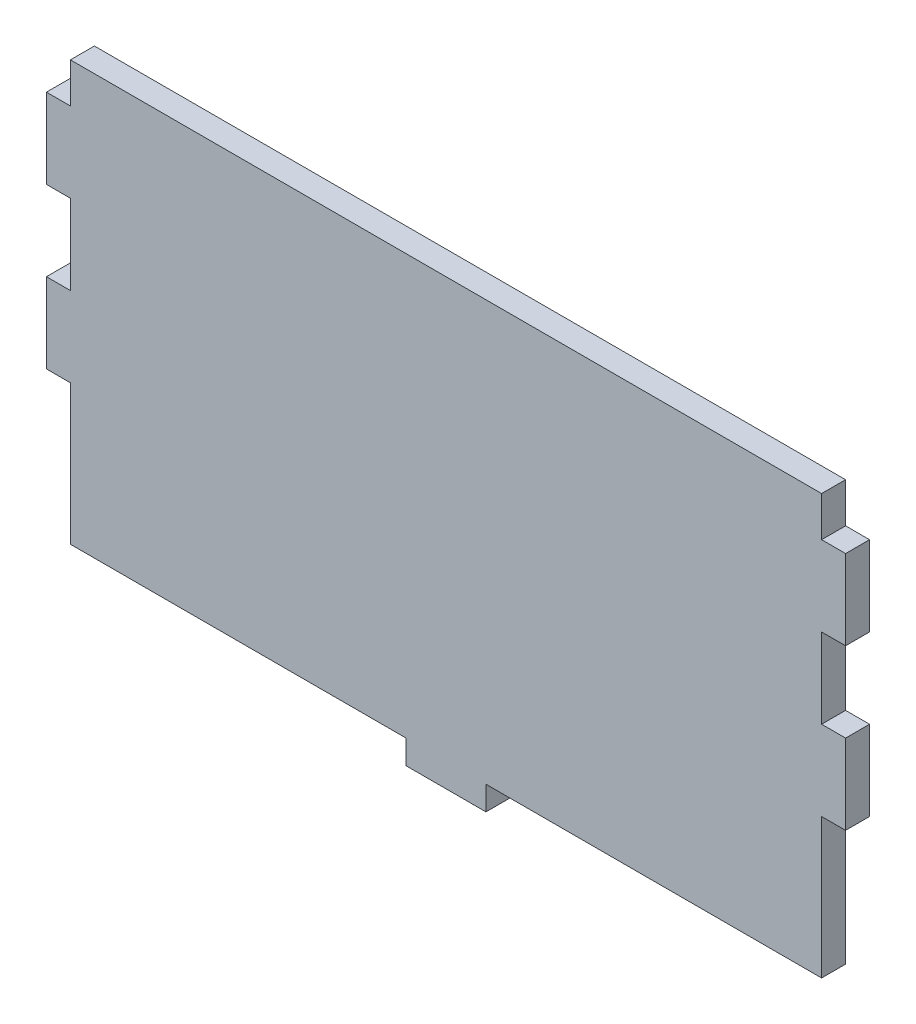
from build123d import *

# Parameters (mm, degrees)
SKETCH_1_W      = 3
SKETCH_1_H      = 10
SKETCH_1_W_2    = 5
SKETCH_1_H_2    = 3
EXTRUDE_1_DEPTH = 3


with BuildPart() as part:
    # 草圖1 → 填料-伸長1 (new body)
    with BuildSketch(Plane.XY):
        with Locations((-48.5, -4.734163056)):
            Rectangle(SKETCH_1_W, SKETCH_1_H)
        Polygon((-5, -27.234163056), (0, -27.234163056), (5, -27.234163056), (47, -27.234163056), (47, -9.734163056), (47, 0.265836944), (47, 10.265836944), (47, 20.265836944), (47, 25.265836944), (-47, 25.265836944), (-47, 20.265836944), (-47, 10.265836944), (-47, 0.265836944), (-47, -9.734163056), (-47, -27.234163056), align=None)
        with Locations((-2.5, -28.734163056)):
            Rectangle(SKETCH_1_W_2, SKETCH_1_H_2)
        with Locations((2.5, -28.734163056)):
            Rectangle(SKETCH_1_W_2, SKETCH_1_H_2)
        with Locations((-48.5, 15.265836944)):
            Rectangle(SKETCH_1_W, SKETCH_1_H)
        with Locations((48.5, 15.265836944)):
            Rectangle(SKETCH_1_W, SKETCH_1_H)
        with Locations((48.5, -4.734163056)):
            Rectangle(SKETCH_1_W, SKETCH_1_H)
    extrude(amount=EXTRUDE_1_DEPTH)


solid = part.part
